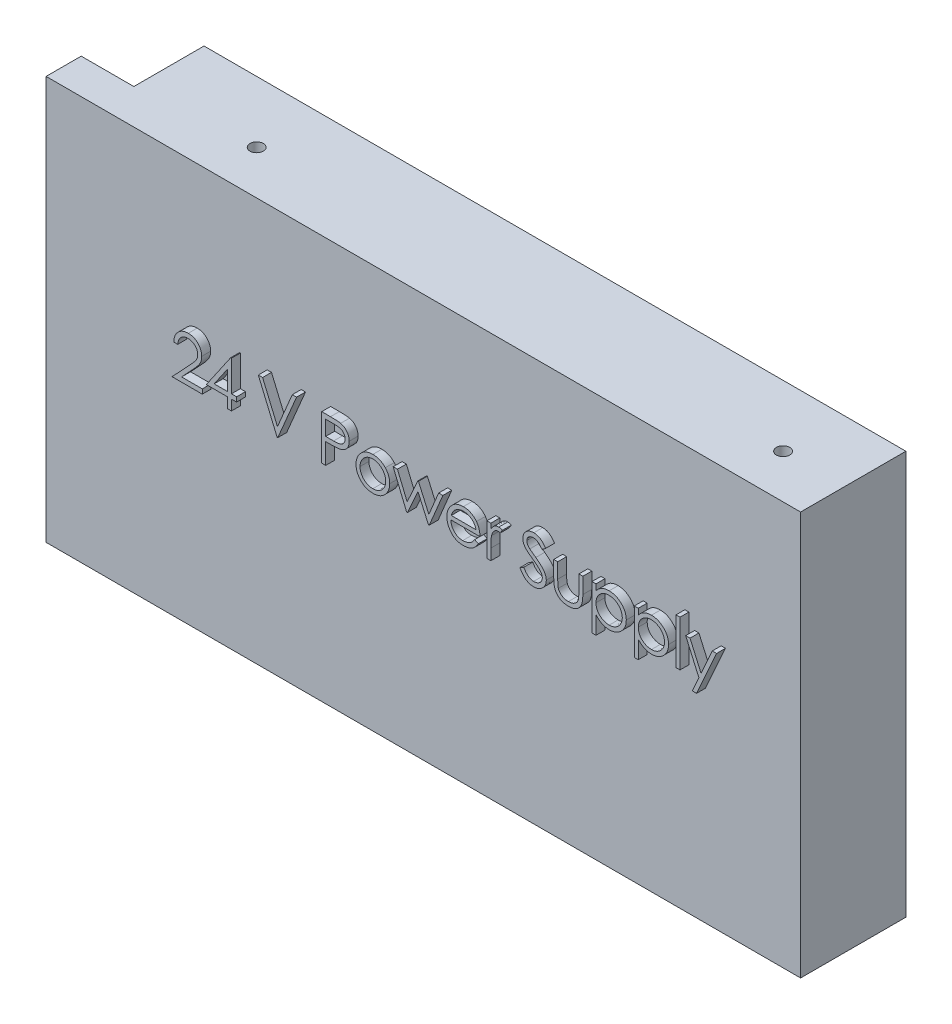
from build123d import *

# Parameters (mm, degrees)
SKETCH1_W           = 200
SKETCH1_H           = 115
BOSS_EXTRUDE1_DEPTH = 30
SKETCH2_W           = 1.13974359
SKETCH2_H           = 13.025641026
BOSS_EXTRUDE2_DEPTH = 2.54
SKETCH3_W           = 10
SKETCH3_H           = 115
BOSS_EXTRUDE3_DEPTH = 15
SKETCH4_R           = 1.905
CUT_EXTRUDE1_DEPTH  = 166.857926107


with BuildPart() as part:
    # Sketch1 → Boss-Extrude1 (new body)
    with BuildSketch(Plane.XY):
        Rectangle(SKETCH1_W, SKETCH1_H)
    extrude(amount=BOSS_EXTRUDE1_DEPTH)

    # Sketch2 → Boss-Extrude2 (add)
    # profile 1 of 14: a face of its own
    with BuildSketch(Plane.XY.offset(30)):
        with BuildLine():
            Line((-74.950266269, 12.669889224), (-76.090009858, 12.669889224))
            add(Edge.make_bspline(
                [(-76.090009858, 12.669889224), (-76.082581617, 12.821095016), (-76.06799275, 13.118059169), (-75.999672958, 13.551034487), (-75.90191606, 13.964890471), (-75.763698499, 14.356304159), (-75.592044291, 14.728736402), (-75.386195334, 15.080707887), (-75.142377648, 15.410875915), (-74.86585607, 15.716179718), (-74.565524151, 15.996260332), (-74.241471171, 16.238123642), (-73.900947786, 16.442476335), (-73.54498711, 16.613313984), (-73.169573065, 16.741547139), (-72.778112409, 16.836694231), (-72.368885257, 16.893939828), (-72.090065749, 16.900093108), (-71.948263064, 16.903222557)],
                knots=[0, 0, 0, 0, 1.10065271, 2.161652631, 3.183658789, 4.190468796, 5.17591951, 6.163126047, 7.15150782, 8.156236427, 9.156009102, 10.134482811, 11.092018607, 12.041330605, 13.001268258, 13.972401359, 14.968799086, 16, 16, 16, 16], degree=3))
            add(Edge.make_bspline(
                [(-71.948263064, 16.903222557), (-71.80900548, 16.899962444), (-71.535369304, 16.893556437), (-71.136001423, 16.83854356), (-70.755809526, 16.752380984), (-70.395536773, 16.631493616), (-70.058057625, 16.468990123), (-69.740836863, 16.273781911), (-69.440097921, 16.048012809), (-69.169381878, 15.782206114), (-68.920795419, 15.498443176), (-68.706338664, 15.195501355), (-68.522685185, 14.882612232), (-68.369604175, 14.557389901), (-68.256914757, 14.216772169), (-68.171359545, 13.865718033), (-68.123000073, 13.500593719), (-68.115578107, 13.253464217), (-68.11180473, 13.127821916)],
                knots=[0, 0, 0, 0, 1.111607364, 2.184268762, 3.212621178, 4.221274766, 5.211760367, 6.196651075, 7.1921475, 8.207485113, 9.220403448, 10.201281604, 11.166441695, 12.114753415, 13.065576456, 14.026450734, 14.996634279, 16, 16, 16, 16], degree=3))
            add(Edge.make_bspline(
                [(-68.11180473, 13.127821916), (-68.117948855, 12.950936916), (-68.130129285, 12.600270998), (-68.234321452, 12.084959925), (-68.39705022, 11.585692375), (-68.592983487, 11.183874165), (-68.790640641, 10.860084059), (-68.968758168, 10.593497615), (-69.17727334, 10.306457773), (-69.419221032, 9.99992572), (-69.689596311, 9.671500436), (-69.990848161, 9.321380321), (-70.325124796, 8.953182757), (-70.559742784, 8.701702432), (-70.681315948, 8.571391627)],
                knots=[0, 0, 0, 0, 1.184426356, 2.348067706, 3.509069118, 4.696110526, 5.333549288, 6.050745305, 6.844228056, 7.710549037, 8.667450064, 9.695053472, 10.805634456, 12, 12, 12, 12], degree=3))
            Line((-70.681315948, 8.571391627), (-73.858860019, 5.180145634))
            Line((-73.858860019, 5.180145634), (-67.948984217, 5.180145634))
            Line((-67.948984217, 5.180145634), (-67.948984217, 3.877581531))
            Line((-67.948984217, 3.877581531), (-76.578471397, 3.877581531))
            Line((-76.578471397, 3.877581531), (-71.653150884, 9.133631211))
            add(Edge.make_bspline(
                [(-71.653150884, 9.133631211), (-71.533234266, 9.25881078), (-71.302898985, 9.499255115), (-70.977116492, 9.850293856), (-70.684512163, 10.175956475), (-70.423191909, 10.475627665), (-70.198824618, 10.753690782), (-69.999716805, 11.001140135), (-69.840184518, 11.228849141), (-69.667045796, 11.492793654), (-69.499355064, 11.815055491), (-69.355255943, 12.208877735), (-69.267390636, 12.614288052), (-69.256850233, 12.888252586), (-69.25154832, 13.026059095)],
                knots=[0, 0, 0, 0, 1.329631726, 2.553950428, 3.673215718, 4.687767853, 5.603093632, 6.413772471, 7.123043292, 7.734684054, 8.834405432, 9.900288307, 10.943827018, 12, 12, 12, 12], degree=3))
            add(Edge.make_bspline(
                [(-69.25154832, 13.026059095), (-69.253855156, 13.112714455), (-69.258401488, 13.28349553), (-69.298525133, 13.533887855), (-69.359160398, 13.775423037), (-69.446047477, 14.008844026), (-69.560734791, 14.231803964), (-69.700338198, 14.444574249), (-69.861410714, 14.650274208), (-70.047742463, 14.843144747), (-70.252435692, 15.019787978), (-70.468677683, 15.176266803), (-70.69745949, 15.30703729), (-70.937816505, 15.41423798), (-71.189078637, 15.498331506), (-71.451731855, 15.556601209), (-71.725050428, 15.593186222), (-71.911680541, 15.598136217), (-72.006776685, 15.600658454)],
                knots=[0, 0, 0, 0, 0.991446411, 1.95395049, 2.89581595, 3.838931463, 4.798493298, 5.75982156, 6.748411868, 7.785213223, 8.824556874, 9.840280684, 10.836137867, 11.835679398, 12.848801643, 13.863922112, 14.911575587, 16, 16, 16, 16], degree=3))
            add(Edge.make_bspline(
                [(-72.006776685, 15.600658454), (-72.106093707, 15.598063909), (-72.301135939, 15.59296865), (-72.587499287, 15.557326412), (-72.860679108, 15.495837219), (-73.121362585, 15.411739001), (-73.369990796, 15.304846552), (-73.605354613, 15.171707936), (-73.826925668, 15.012836404), (-74.035120482, 14.832712099), (-74.226941206, 14.63216966), (-74.395477012, 14.408613509), (-74.542739007, 14.166125459), (-74.67122394, 13.905359804), (-74.775566015, 13.623950374), (-74.855297161, 13.32289613), (-74.918386576, 13.00350426), (-74.939463208, 12.782941238), (-74.950266269, 12.669889224)],
                knots=[0, 0, 0, 0, 1.031018746, 2.02475058, 2.990194455, 3.934040569, 4.864654155, 5.795059489, 6.735614925, 7.690564532, 8.649604399, 9.611025574, 10.590972636, 11.591080095, 12.624614302, 13.701020113, 14.821632451, 16, 16, 16, 16], degree=3))
        make_face()
    # profile 2 of 14: a face of its own
    with BuildSketch(Plane.XY.offset(30)):
        Polygon((-59.87664848, 16.903222557), (-59.645138064, 16.903222557), (-59.645138064, 8.110914865), (-58.179753448, 8.110914865), (-58.179753448, 6.808350762), (-59.645138064, 6.808350762), (-59.645138064, 3.877581531), (-60.784881653, 3.877581531), (-60.784881653, 6.808350762), (-66.809240628, 6.808350762), align=None)
        Polygon((-60.784881653, 8.110914865), (-60.784881653, 13.626459736), (-64.570458576, 8.110914865), align=None, mode=Mode.SUBTRACT)
    # profile 3 of 14: a face of its own
    with BuildSketch(Plane.XY.offset(30)):
        Polygon((-51.992573961, 16.577581531), (-50.771420115, 16.577581531), (-46.538086781, 6.569208134), (-42.304753448, 16.577581531), (-41.083599602, 16.577581531), (-46.456676525, 3.877581531), (-46.619497038, 3.877581531), align=None)
    # profile 4 of 14: a face of its own
    with BuildSketch(Plane.XY.offset(30)):
        with BuildLine():
            Line((-33.919497038, 16.577581531), (-31.428852006, 16.577581531))
            add(Edge.make_bspline(
                [(-31.428852006, 16.577581531), (-31.257543861, 16.577393222), (-30.929309847, 16.577032413), (-30.458629502, 16.566093193), (-30.031148476, 16.551482053), (-29.647788522, 16.531227755), (-29.307370109, 16.507291556), (-29.011433622, 16.47371987), (-28.757652946, 16.438666798), (-28.605592401, 16.403029123), (-28.536243833, 16.386776243)],
                knots=[0, 0, 0, 0, 1.415646017, 2.712440637, 3.8905458, 4.950247383, 5.884950622, 6.709939814, 7.411656543, 8, 8, 8, 8], degree=3))
            add(Edge.make_bspline(
                [(-28.536243833, 16.386776243), (-28.448455867, 16.362748025), (-28.27494855, 16.315257784), (-28.024936194, 16.220139416), (-27.787069383, 16.107355559), (-27.560532014, 15.978817263), (-27.348107884, 15.829009645), (-27.146627678, 15.664005375), (-26.957869464, 15.479994826), (-26.782894699, 15.279041855), (-26.622204148, 15.064519951), (-26.48384787, 14.833226717), (-26.367997646, 14.589055416), (-26.26863549, 14.332175886), (-26.197121955, 14.060430998), (-26.143248919, 13.775708928), (-26.109054613, 13.478040194), (-26.105779603, 13.274622961), (-26.104112422, 13.171071115)],
                knots=[0, 0, 0, 0, 0.999701418, 1.975846123, 2.934577507, 3.890451536, 4.834027766, 5.787354733, 6.749476667, 7.726910423, 8.712836071, 9.690891519, 10.682875813, 11.679750201, 12.712814741, 13.765529915, 14.8625177, 16, 16, 16, 16], degree=3))
            add(Edge.make_bspline(
                [(-26.104112422, 13.171071115), (-26.105641592, 13.066648896), (-26.108633516, 12.862339773), (-26.144542894, 12.563444227), (-26.192912447, 12.277808926), (-26.267287465, 12.006067205), (-26.364698908, 11.749832838), (-26.478970071, 11.505190082), (-26.616796024, 11.276300987), (-26.775164406, 11.062334589), (-26.951337334, 10.86309005), (-27.144569424, 10.680011224), (-27.354080571, 10.514169768), (-27.579204937, 10.365193892), (-27.822137246, 10.236538249), (-28.07919306, 10.1213046), (-28.352606702, 10.024526751), (-28.541809539, 9.973617671), (-28.638006653, 9.947733775)],
                knots=[0, 0, 0, 0, 1.121902311, 2.195077645, 3.232258892, 4.234102512, 5.217864754, 6.176164875, 7.132989551, 8.084763148, 9.034132444, 9.988522005, 10.94243251, 11.903244335, 12.886203696, 13.894208494, 14.929344452, 16, 16, 16, 16], degree=3))
            add(Edge.make_bspline(
                [(-28.638006653, 9.947733775), (-28.717571551, 9.930813815), (-28.89194265, 9.893732739), (-29.179117671, 9.852336339), (-29.513473785, 9.817002759), (-29.89455463, 9.79051006), (-30.322018142, 9.767830151), (-30.796095561, 9.749803068), (-31.317717498, 9.739897598), (-31.68155887, 9.739386721), (-31.871520275, 9.739119993)],
                knots=[0, 0, 0, 0, 0.601384939, 1.31797006, 2.144135048, 3.087295005, 4.142315834, 5.309527816, 6.595305764, 8, 8, 8, 8], degree=3))
            Line((-31.871520275, 9.739119993), (-32.779753448, 9.739119993))
            Line((-32.779753448, 9.739119993), (-32.779753448, 3.877581531))
            Line((-32.779753448, 3.877581531), (-33.919497038, 3.877581531))
            Line((-33.919497038, 3.877581531), (-33.919497038, 16.577581531))
        make_face()
        with BuildLine():
            Line((-32.779753448, 15.275017429), (-32.779753448, 11.041684095))
            Line((-32.779753448, 11.041684095), (-30.55623582, 11.01369932))
            add(Edge.make_bspline(
                [(-30.55623582, 11.01369932), (-30.447669232, 11.013643209), (-30.238083672, 11.013534888), (-29.935329376, 11.027995556), (-29.654444248, 11.044688918), (-29.396291075, 11.069130697), (-29.160753484, 11.10367926), (-28.947438736, 11.138556138), (-28.758000881, 11.189012739), (-28.536298063, 11.256950733), (-28.289252774, 11.37282051), (-28.020493384, 11.541004396), (-27.792725827, 11.755382966), (-27.595628008, 11.996421097), (-27.439215251, 12.264569367), (-27.324712079, 12.551476651), (-27.257434165, 12.854200562), (-27.248412833, 13.061348952), (-27.243856012, 13.165982974)],
                knots=[0, 0, 0, 0, 1.160613943, 2.240541288, 3.23993089, 4.169200891, 5.011653406, 5.7853311, 6.478053781, 7.106038997, 8.262395093, 9.384106736, 10.481365981, 11.59014053, 12.70357646, 13.786202915, 14.881775077, 16, 16, 16, 16], degree=3))
            add(Edge.make_bspline(
                [(-27.243856012, 13.165982974), (-27.248437615, 13.26808558), (-27.257545275, 13.471052923), (-27.325239407, 13.768518712), (-27.438992632, 14.052402554), (-27.596677989, 14.317190606), (-27.788052946, 14.557361409), (-28.010481991, 14.765993842), (-28.263441539, 14.933712591), (-28.498747978, 15.041964785), (-28.707757996, 15.108060213), (-28.889302536, 15.154305777), (-29.094282983, 15.191228691), (-29.322766069, 15.221126315), (-29.572980866, 15.246720303), (-29.847077037, 15.264086563), (-30.144016257, 15.274251848), (-30.350157471, 15.274756057), (-30.45701707, 15.275017429)],
                knots=[0, 0, 0, 0, 1.120700087, 2.227813068, 3.331159281, 4.466773991, 5.599788987, 6.693661531, 7.80175334, 8.91857717, 9.525282508, 10.207424825, 10.974604443, 11.810962634, 12.737642355, 13.736264703, 14.826523623, 16, 16, 16, 16], degree=3))
            Line((-30.45701707, 15.275017429), (-32.779753448, 15.275017429))
        make_face(mode=Mode.SUBTRACT)
    # profile 5 of 14: a face of its own
    with BuildSketch(Plane.XY.offset(30)):
        with BuildLine():
            add(Edge.make_bspline(
                [(-19.341972999, 13.321171275), (-19.167833238, 13.31746327), (-18.826387723, 13.310192778), (-18.326341966, 13.232487046), (-17.849021044, 13.113660895), (-17.392596861, 12.949389798), (-16.962914875, 12.729201006), (-16.553716361, 12.466458721), (-16.166123214, 12.155190453), (-15.933811079, 11.914405462), (-15.815891269, 11.792184897)],
                knots=[0, 0, 0, 0, 1.054011418, 2.066658804, 3.057071809, 4.030435133, 4.997543892, 5.974964718, 6.972108034, 8, 8, 8, 8], degree=3))
            add(Edge.make_bspline(
                [(-15.815891269, 11.792184897), (-15.71435675, 11.675294148), (-15.513252684, 11.443774809), (-15.255385647, 11.068378728), (-15.033238843, 10.67961322), (-14.855210385, 10.272315778), (-14.714839013, 9.850041971), (-14.615177773, 9.411340388), (-14.555898037, 8.957179871), (-14.547904414, 8.648737373), (-14.543856012, 8.492525442)],
                knots=[0, 0, 0, 0, 1.025258237, 2.030674902, 3.01204498, 3.988269485, 4.97094183, 5.956517959, 6.965070386, 8, 8, 8, 8], degree=3))
            add(Edge.make_bspline(
                [(-14.543856012, 8.492525442), (-14.547416865, 8.335408089), (-14.554453275, 8.024936874), (-14.621014398, 7.567666604), (-14.724541481, 7.124273962), (-14.872702722, 6.696615273), (-15.062687862, 6.283383299), (-15.294519785, 5.886382935), (-15.569825367, 5.504830908), (-15.881897013, 5.141967095), (-16.226799535, 4.807535402), (-16.600963844, 4.516058538), (-16.997037052, 4.266334721), (-17.420285791, 4.065179727), (-17.866844958, 3.906575957), (-18.337677748, 3.795178755), (-18.832052717, 3.727826359), (-19.169608635, 3.719177393), (-19.341972999, 3.714761019)],
                knots=[0, 0, 0, 0, 0.998656419, 1.973391657, 2.932242238, 3.890759089, 4.846373663, 5.82037756, 6.809684879, 7.83454468, 8.860553229, 9.859544525, 10.845671541, 11.83227036, 12.833544569, 13.85385346, 14.904124723, 16, 16, 16, 16], degree=3))
            add(Edge.make_bspline(
                [(-19.341972999, 3.714761019), (-19.515181839, 3.719192216), (-19.854420101, 3.727870941), (-20.350540093, 3.794917081), (-20.82221671, 3.906524618), (-21.269360482, 4.065700948), (-21.694428926, 4.26634115), (-22.092797073, 4.515303567), (-22.467265337, 4.807621844), (-22.812240824, 5.141943673), (-23.124292906, 5.504836943), (-23.399603536, 5.886381368), (-23.631434148, 6.283383707), (-23.821419631, 6.696615164), (-23.969580781, 7.124273991), (-24.073107888, 7.567666596), (-24.139669004, 8.024936876), (-24.146705416, 8.33540809), (-24.150266269, 8.492525442)],
                knots=[0, 0, 0, 0, 1.099876186, 2.154163076, 3.173186993, 4.173200201, 5.163417411, 6.152872554, 7.150605724, 8.17532212, 9.198891216, 10.186952605, 11.159729845, 12.11414092, 13.071450619, 14.029093627, 15.002601286, 16, 16, 16, 16], degree=3))
            add(Edge.make_bspline(
                [(-24.150266269, 8.492525442), (-24.146190257, 8.647888337), (-24.138120454, 8.955480168), (-24.078900321, 9.408786931), (-23.979627845, 9.846746029), (-23.839088206, 10.267389899), (-23.659418799, 10.672902481), (-23.440393554, 11.062628582), (-23.179896116, 11.436327172), (-22.979591892, 11.667547291), (-22.878231012, 11.784552685)],
                knots=[0, 0, 0, 0, 1.031353054, 2.041901799, 3.029428768, 4.008703097, 4.981709435, 5.96992636, 6.972712378, 8, 8, 8, 8], degree=3))
            add(Edge.make_bspline(
                [(-22.878231012, 11.784552685), (-22.760488982, 11.907833179), (-22.528928562, 12.150285962), (-22.139406035, 12.460646836), (-21.73121417, 12.728856589), (-21.296783724, 12.944670285), (-20.840734496, 13.114627193), (-20.360967531, 13.23279349), (-19.859224946, 13.309912807), (-19.516108607, 13.317381052), (-19.341972999, 13.321171275)],
                knots=[0, 0, 0, 0, 1.027980169, 2.021703884, 2.998553061, 3.971491411, 4.943284454, 5.930300938, 6.949603206, 8, 8, 8, 8], degree=3))
        make_face()
        with BuildLine():
            add(Edge.make_bspline(
                [(-19.34706114, 12.181427685), (-19.470206187, 12.177927595), (-19.713317311, 12.17101777), (-20.071165519, 12.118461887), (-20.415662649, 12.03519523), (-20.747462283, 11.916889083), (-21.065445509, 11.764130221), (-21.369916769, 11.576502742), (-21.661771622, 11.356491729), (-21.935300824, 11.104441463), (-22.186333785, 10.829109112), (-22.405782443, 10.535745067), (-22.592382114, 10.229107753), (-22.747830691, 9.908878301), (-22.863608202, 9.571811542), (-22.94769317, 9.22172468), (-23.000199471, 8.857904455), (-23.00704433, 8.610577331), (-23.010522679, 8.48489323)],
                knots=[0, 0, 0, 0, 1.021534396, 2.016698045, 2.994645724, 3.958388632, 4.93408049, 5.916473867, 6.921342795, 7.962252576, 8.998418191, 10.008913653, 10.997312074, 11.973003931, 12.956656626, 13.948281152, 14.957379055, 16, 16, 16, 16], degree=3))
            add(Edge.make_bspline(
                [(-23.010522679, 8.48489323), (-23.004692205, 8.322507303), (-22.993119803, 8.000201603), (-22.899011945, 7.525544101), (-22.74158173, 7.06986138), (-22.528993601, 6.635824779), (-22.262633893, 6.234242513), (-21.948809394, 5.876205984), (-21.590888195, 5.567103183), (-21.193136895, 5.310632686), (-20.763679798, 5.106853001), (-20.30917829, 4.962439575), (-19.8351392, 4.868562291), (-19.51117769, 4.859231513), (-19.34706114, 4.854504608)],
                knots=[0, 0, 0, 0, 1.016792936, 2.018143844, 3.017858371, 4.030088057, 5.03801393, 6.028138512, 7.003788237, 7.991172063, 8.984598303, 9.972568034, 10.972917682, 12, 12, 12, 12], degree=3))
            add(Edge.make_bspline(
                [(-19.34706114, 4.854504608), (-19.18295403, 4.859259054), (-18.859011153, 4.868644197), (-18.385630712, 4.961966772), (-17.932371442, 5.107485769), (-17.503360408, 5.310403502), (-17.105790161, 5.568077121), (-16.745294778, 5.874460547), (-16.434149818, 6.235190807), (-16.168053594, 6.636356698), (-15.951983985, 7.06918849), (-15.795290653, 7.525628203), (-15.700956555, 8.000180184), (-15.689414691, 8.322500127), (-15.683599602, 8.48489323)],
                knots=[0, 0, 0, 0, 1.02726834, 2.027799167, 3.010890988, 4.004497153, 4.992059811, 5.971914811, 6.958719428, 7.966827853, 8.981595046, 9.981490638, 10.983022906, 12, 12, 12, 12], degree=3))
            add(Edge.make_bspline(
                [(-15.683599602, 8.48489323), (-15.687076753, 8.610578082), (-15.693919256, 8.857906684), (-15.746442698, 9.221716158), (-15.830464228, 9.571842809), (-15.946475525, 9.908762935), (-16.101248661, 10.22993688), (-16.291446738, 10.534844746), (-16.509999316, 10.830125356), (-16.764061441, 11.103551424), (-17.037305126, 11.356589986), (-17.329278265, 11.576588056), (-17.633298044, 11.763305616), (-17.950357473, 11.918195689), (-18.282199647, 12.034118896), (-18.626214087, 12.118942673), (-18.982535483, 12.170795672), (-19.22477544, 12.177861014), (-19.34706114, 12.181427685)],
                knots=[0, 0, 0, 0, 1.042956736, 2.052379634, 3.044323526, 4.02829302, 5.004299113, 5.996692471, 7.007513377, 8.048758398, 9.090003419, 10.095195979, 11.07790575, 12.047570684, 13.018257071, 13.989683339, 14.985167495, 16, 16, 16, 16], degree=3))
        make_face(mode=Mode.SUBTRACT)
    # profile 6 of 14: a face of its own
    with BuildSketch(Plane.XY.offset(30)):
        Polygon((-13.566932935, 13.158350762), (-12.343235019, 13.158350762), (-9.577830371, 6.482709736), (-6.54784239, 13.158350762), (-6.354493031, 13.158350762), (-3.390650884, 6.482709736), (-0.599805531, 13.158350762), (0.59845168, 13.158350762), (-3.281255852, 3.877581531), (-3.51785441, 3.877581531), (-6.484240628, 10.553222557), (-9.511684538, 3.877581531), (-9.72284239, 3.877581531), align=None)
    # profile 7 of 14: a face of its own
    with BuildSketch(Plane.XY.offset(30)):
        with BuildLine():
            Line((9.680783411, 6.808350762), (10.693323475, 6.276640025))
            add(Edge.make_bspline(
                [(10.693323475, 6.276640025), (10.612636401, 6.13351708), (10.455651307, 5.855056507), (10.185682879, 5.47248947), (9.902683073, 5.128327759), (9.593877246, 4.83176587), (9.268504411, 4.57322513), (8.924760207, 4.347027881), (8.560855068, 4.154283535), (8.176771781, 3.991895791), (7.769284838, 3.867038484), (7.337406764, 3.778848883), (6.880310195, 3.724335879), (6.566996914, 3.718003511), (6.406564661, 3.714761019)],
                knots=[0, 0, 0, 0, 1.120438281, 2.179929193, 3.190490725, 4.156257408, 5.095198341, 6.022838206, 6.959905092, 7.901321166, 8.864066838, 9.862729781, 10.905609505, 12, 12, 12, 12], degree=3))
            add(Edge.make_bspline(
                [(6.406564661, 3.714761019), (6.228249485, 3.718923626), (5.880408236, 3.727043668), (5.374078296, 3.797047753), (4.897358692, 3.911247454), (4.450276226, 4.070779562), (4.033925767, 4.27915871), (3.647479808, 4.533011686), (3.288906099, 4.831034439), (2.969503969, 5.175808391), (2.68196188, 5.544768636), (2.428231048, 5.929237131), (2.216114084, 6.328246546), (2.043566041, 6.739256733), (1.904211245, 7.159677147), (1.807086349, 7.593333043), (1.751098406, 8.039050735), (1.742518847, 8.340575353), (1.73819527, 8.492525442)],
                knots=[0, 0, 0, 0, 1.145258523, 2.234067595, 3.276747158, 4.290159414, 5.277019952, 6.260822364, 7.254936242, 8.264827045, 9.274100331, 10.257902744, 11.220704747, 12.172965371, 13.118907548, 14.062713208, 15.023725156, 16, 16, 16, 16], degree=3))
            add(Edge.make_bspline(
                [(1.73819527, 8.492525442), (1.74203844, 8.635109541), (1.749655095, 8.917692395), (1.797663952, 9.335941657), (1.882747759, 9.742444899), (1.999501848, 10.137539896), (2.150273513, 10.520565125), (2.334721851, 10.891753699), (2.553134194, 11.250710635), (2.72176361, 11.477144863), (2.806704885, 11.591203326)],
                knots=[0, 0, 0, 0, 1.024358464, 2.0301432, 3.019427413, 4.004406732, 4.986367066, 5.972626655, 6.978780325, 8, 8, 8, 8], degree=3))
            add(Edge.make_bspline(
                [(2.806704885, 11.591203326), (2.921758477, 11.728613226), (3.148221055, 11.999080229), (3.53123983, 12.35445644), (3.945986257, 12.652158138), (4.387262728, 12.89892689), (4.860197934, 13.086428409), (5.358434505, 13.226155921), (5.887645632, 13.304453276), (6.249433147, 13.315512558), (6.434549436, 13.321171275)],
                knots=[0, 0, 0, 0, 1.030682036, 2.02871468, 2.997146059, 3.962720338, 4.930598197, 5.918074684, 6.934738563, 8, 8, 8, 8], degree=3))
            add(Edge.make_bspline(
                [(6.434549436, 13.321171275), (6.624859319, 13.316258012), (6.998203925, 13.30661931), (7.542606193, 13.2172609), (8.057720793, 13.075555916), (8.543341594, 12.875426448), (8.999517832, 12.617218931), (9.423284355, 12.297389964), (9.821888415, 11.925758618), (10.053785258, 11.639960687), (10.17178902, 11.494528647)],
                knots=[0, 0, 0, 0, 1.056321875, 2.072262726, 3.055038591, 4.01806755, 4.982017516, 5.957941055, 6.960871419, 8, 8, 8, 8], degree=3))
            add(Edge.make_bspline(
                [(10.17178902, 11.494528647), (10.252078196, 11.384932794), (10.412122119, 11.166470592), (10.612590168, 10.810249536), (10.786607001, 10.437556808), (10.925700889, 10.042368016), (11.038329936, 9.629365539), (11.119816107, 9.195596877), (11.167603008, 8.741191199), (11.176996282, 8.431577697), (11.181785013, 8.273735377)],
                knots=[0, 0, 0, 0, 0.94817472, 1.890038105, 2.849395472, 3.817997239, 4.812318967, 5.836947057, 6.897266129, 8, 8, 8, 8], degree=3))
            Line((11.181785013, 8.273735377), (2.87793886, 8.273735377))
            add(Edge.make_bspline(
                [(2.87793886, 8.273735377), (2.883525431, 8.151450836), (2.8945112, 7.910983216), (2.945729005, 7.559117804), (3.02646027, 7.223934533), (3.139922297, 6.907947495), (3.27732485, 6.607029604), (3.445638737, 6.32341307), (3.646442261, 6.058389724), (3.87041837, 5.809588967), (4.119726973, 5.588025634), (4.382010084, 5.38971776), (4.661023877, 5.223508881), (4.954568352, 5.088598995), (5.262168829, 4.982984648), (5.583922223, 4.910892842), (5.919195388, 4.862607054), (6.147743623, 4.857237983), (6.264096712, 4.854504608)],
                knots=[0, 0, 0, 0, 1.094153842, 2.151609401, 3.174256925, 4.172055639, 5.149267565, 6.128595816, 7.11444997, 8.118368179, 9.117203808, 10.09244225, 11.054858984, 12.015122123, 12.976791628, 13.957293641, 14.960065497, 16, 16, 16, 16], degree=3))
            add(Edge.make_bspline(
                [(6.264096712, 4.854504608), (6.377856591, 4.856710985), (6.603578012, 4.861088861), (6.93973198, 4.903658937), (7.270438265, 4.972493937), (7.594328119, 5.066437616), (7.904828045, 5.181016479), (8.192376184, 5.31927542), (8.456827252, 5.472218786), (8.703994531, 5.647151036), (8.94373785, 5.861266457), (9.181563443, 6.128458931), (9.4365673, 6.444462246), (9.596186679, 6.682299377), (9.680783411, 6.808350762)],
                knots=[0, 0, 0, 0, 0.99110716, 1.966546729, 2.947904876, 3.932708344, 4.903319531, 5.828989031, 6.710028674, 7.56322171, 8.463672341, 9.504779593, 10.677557249, 12, 12, 12, 12], degree=3))
        make_face()
        with BuildLine():
            add(Edge.make_bspline(
                [(10.042041424, 9.413478967), (10.0003251, 9.56465568), (9.920034606, 9.855622189), (9.752262655, 10.258541992), (9.563317351, 10.61663809), (9.339718497, 10.927169901), (9.086376264, 11.202954077), (8.793749458, 11.443958657), (8.465596359, 11.659559123), (8.103613191, 11.841541049), (7.720284428, 11.996444251), (7.31894196, 12.100312528), (6.909429416, 12.171467153), (6.632445005, 12.178093318), (6.493063058, 12.181427685)],
                knots=[0, 0, 0, 0, 1.154881502, 2.222775134, 3.210006277, 4.132804581, 5.035138423, 5.962687519, 6.919655026, 7.923214229, 8.944639381, 9.960483929, 10.97369054, 12, 12, 12, 12], degree=3))
            add(Edge.make_bspline(
                [(6.493063058, 12.181427685), (6.379309381, 12.179208191), (6.154442278, 12.174820718), (5.82314983, 12.133200535), (5.50499778, 12.064403384), (5.197638593, 11.970187684), (4.905100014, 11.844607898), (4.621364712, 11.697348761), (4.353647274, 11.517583586), (4.186220288, 11.380572884), (4.101636776, 11.31135557)],
                knots=[0, 0, 0, 0, 1.04873581, 2.073130211, 3.073294108, 4.04793562, 5.032784715, 6.005352987, 6.992311501, 8, 8, 8, 8], degree=3))
            add(Edge.make_bspline(
                [(4.101636776, 11.31135557), (4.04106401, 11.256584767), (3.918479495, 11.145742012), (3.754683888, 10.954773177), (3.597855316, 10.74884608), (3.455130347, 10.520082342), (3.324220248, 10.271086944), (3.201719759, 10.003960096), (3.091460492, 9.716674738), (3.029426036, 9.516477601), (2.997510174, 9.413478967)],
                knots=[0, 0, 0, 0, 0.879870761, 1.780643979, 2.707998968, 3.669668524, 4.684282772, 5.740141944, 6.837334558, 8, 8, 8, 8], degree=3))
            Line((2.997510174, 9.413478967), (10.042041424, 9.413478967))
        make_face(mode=Mode.SUBTRACT)
    # profile 8 of 14: a face of its own
    with BuildSketch(Plane.XY.offset(30)):
        with BuildLine():
            Line((13.135631167, 13.158350762), (14.275374757, 13.158350762))
            Line((14.275374757, 13.158350762), (14.275374757, 11.792184897))
            add(Edge.make_bspline(
                [(14.275374757, 11.792184897), (14.359516824, 11.919387474), (14.520437875, 12.162661414), (14.787910504, 12.484404306), (15.061879735, 12.750796047), (15.343657129, 12.963080243), (15.635314805, 13.122059275), (15.930451745, 13.238511145), (16.233711307, 13.307371688), (16.43749886, 13.316565251), (16.539597513, 13.321171275)],
                knots=[0, 0, 0, 0, 1.2804753, 2.448899062, 3.506932113, 4.484331642, 5.4025378, 6.288909075, 7.142734305, 8, 8, 8, 8], degree=3))
            add(Edge.make_bspline(
                [(16.539597513, 13.321171275), (16.618795898, 13.316851364), (16.781751722, 13.307962867), (17.028431405, 13.24551216), (17.282589073, 13.145806193), (17.44639145, 13.052043099), (17.531785013, 13.003162461)],
                knots=[0, 0, 0, 0, 0.901110191, 1.854092781, 2.881294221, 4, 4, 4, 4], degree=3))
            Line((17.531785013, 13.003162461), (16.905943667, 12.016063102))
            add(Edge.make_bspline(
                [(16.905943667, 12.016063102), (16.851119505, 12.040520639), (16.747052749, 12.086945726), (16.594817609, 12.141889592), (16.454459616, 12.174241629), (16.365038704, 12.179142804), (16.32335152, 12.181427685)],
                knots=[0, 0, 0, 0, 1.180555205, 2.24091978, 3.179933427, 4, 4, 4, 4], degree=3))
            add(Edge.make_bspline(
                [(16.32335152, 12.181427685), (16.231890715, 12.17533155), (16.045337186, 12.1628972), (15.771436288, 12.065147812), (15.505653571, 11.907213369), (15.294573539, 11.732058192), (15.131134507, 11.563156184), (15.014511403, 11.415660552), (14.90753115, 11.250275232), (14.805313493, 11.069827522), (14.712181511, 10.871236366), (14.625260283, 10.656485849), (14.546669552, 10.425327239), (14.501855809, 10.264282094), (14.478900398, 10.181788262)],
                knots=[0, 0, 0, 0, 1.125678352, 2.296057538, 3.5422874, 4.923748041, 5.663163013, 6.437101912, 7.23742474, 8.08941207, 8.991984279, 9.93940061, 10.944477711, 12, 12, 12, 12], degree=3))
            add(Edge.make_bspline(
                [(14.478900398, 10.181788262), (14.461728571, 10.108211089), (14.423694278, 9.945243243), (14.386713555, 9.671835739), (14.35017559, 9.348807034), (14.324425003, 8.975257969), (14.300556107, 8.552121386), (14.287093809, 8.078752669), (14.275833842, 7.554665938), (14.275532428, 7.188273285), (14.275374757, 6.99661198)],
                knots=[0, 0, 0, 0, 0.566838948, 1.255505196, 2.06880316, 3.007127437, 4.065329342, 5.249902469, 6.561414163, 8, 8, 8, 8], degree=3))
            Line((14.275374757, 6.99661198), (14.275374757, 3.877581531))
            Line((14.275374757, 3.877581531), (13.135631167, 3.877581531))
            Line((13.135631167, 3.877581531), (13.135631167, 13.158350762))
        make_face()
    # profile 9 of 14: a face of its own
    with BuildSketch(Plane.XY.offset(30)):
        with BuildLine():
            Line((22.579220911, 6.327521435), (23.652818667, 6.971171275))
            add(Edge.make_bspline(
                [(23.652818667, 6.971171275), (23.752670557, 6.804023364), (23.943982924, 6.483774417), (24.263120712, 6.051038098), (24.59380299, 5.683238272), (24.938478572, 5.382514582), (25.295043584, 5.145754336), (25.665825721, 4.978106238), (26.049575492, 4.873545413), (26.310737644, 4.860845099), (26.441119949, 4.854504608)],
                knots=[0, 0, 0, 0, 1.272034388, 2.437168799, 3.508375237, 4.49857839, 5.41946034, 6.295179144, 7.148887113, 8, 8, 8, 8], degree=3))
            add(Edge.make_bspline(
                [(26.441119949, 4.854504608), (26.552469415, 4.857605849), (26.773219991, 4.863754065), (27.098202987, 4.922830118), (27.413822669, 5.013588414), (27.713574012, 5.143567223), (27.993320956, 5.300824014), (28.238636679, 5.490765858), (28.450712576, 5.703422661), (28.624191363, 5.940668294), (28.757287491, 6.19581909), (28.859584425, 6.457714685), (28.916353692, 6.730469204), (28.92490534, 6.914112884), (28.929220911, 7.006788262)],
                knots=[0, 0, 0, 0, 1.095163259, 2.171163733, 3.241058638, 4.321873601, 5.38011039, 6.391990106, 7.366004449, 8.327778327, 9.272591725, 10.192022065, 11.087607919, 12, 12, 12, 12], degree=3))
            add(Edge.make_bspline(
                [(28.929220911, 7.006788262), (28.923871269, 7.112527917), (28.912996229, 7.327481183), (28.821079145, 7.644617067), (28.676483306, 7.958461535), (28.543087427, 8.152594699), (28.473832289, 8.253382813)],
                knots=[0, 0, 0, 0, 0.938893495, 1.908633276, 2.914225137, 4, 4, 4, 4], degree=3))
            add(Edge.make_bspline(
                [(28.473832289, 8.253382813), (28.416970346, 8.326124145), (28.29759581, 8.478835471), (28.092372835, 8.706148183), (27.851558649, 8.940620731), (27.583394321, 9.191206452), (27.278111399, 9.446250743), (26.945271561, 9.717915637), (26.576376987, 9.995869931), (26.317661671, 10.182278955), (26.184168828, 10.278462942)],
                knots=[0, 0, 0, 0, 0.722233717, 1.516239348, 2.393582979, 3.351407094, 4.387010283, 5.505090956, 6.712668013, 8, 8, 8, 8], degree=3))
            add(Edge.make_bspline(
                [(26.184168828, 10.278462942), (26.050550327, 10.373635245), (25.795081929, 10.555597443), (25.43781793, 10.825651273), (25.118342307, 11.072553314), (24.838075019, 11.298627872), (24.597139339, 11.503905609), (24.393636676, 11.686415274), (24.232751055, 11.851092767), (24.143286519, 11.957922778), (24.103119148, 12.00588682)],
                knots=[0, 0, 0, 0, 1.452282411, 2.77665338, 3.964542531, 5.026858415, 5.96415736, 6.766646006, 7.446254459, 8, 8, 8, 8], degree=3))
            add(Edge.make_bspline(
                [(24.103119148, 12.00588682), (24.046975912, 12.080639154), (23.936562705, 12.22764965), (23.790817485, 12.45742842), (23.666941094, 12.692644268), (23.569832061, 12.933929263), (23.488057781, 13.177896005), (23.433056147, 13.427727668), (23.398615935, 13.682303226), (23.395089012, 13.853620785), (23.393323475, 13.93938041)],
                knots=[0, 0, 0, 0, 1.068054152, 2.10047183, 3.106115577, 4.101338837, 5.06977816, 6.043150881, 7.020423561, 8, 8, 8, 8], degree=3))
            add(Edge.make_bspline(
                [(23.393323475, 13.93938041), (23.398059519, 14.073745592), (23.407430378, 14.339603994), (23.486680254, 14.727973008), (23.611767611, 15.098763721), (23.787009062, 15.448305218), (24.012914314, 15.767496063), (24.274338278, 16.060007859), (24.585711385, 16.305911), (24.927350904, 16.520766183), (25.301298311, 16.688935683), (25.693151018, 16.815794097), (26.103531822, 16.887673403), (26.381491767, 16.897988579), (26.522530206, 16.903222557)],
                knots=[0, 0, 0, 0, 1.005424448, 1.989358655, 2.955360095, 3.929531133, 4.905563448, 5.876582895, 6.856512386, 7.866279853, 8.892233794, 9.918561126, 10.94386622, 12, 12, 12, 12], degree=3))
            add(Edge.make_bspline(
                [(26.522530206, 16.903222557), (26.67218737, 16.898060727), (26.969807703, 16.887795494), (27.407592, 16.798541595), (27.829089456, 16.6508563), (28.168155017, 16.483257456), (28.433522466, 16.315866319), (28.63589781, 16.163394385), (28.840975417, 15.987861848), (29.050409502, 15.788801155), (29.260651323, 15.564385801), (29.474822136, 15.31615273), (29.693422768, 15.045618941), (29.834051175, 14.852490039), (29.906143988, 14.753482974)],
                knots=[0, 0, 0, 0, 1.286793592, 2.559021753, 3.825965368, 5.121522368, 5.803751409, 6.523245864, 7.299691795, 8.125521123, 9.008227632, 9.944561021, 10.946284179, 12, 12, 12, 12], degree=3))
            Line((29.906143988, 14.753482974), (28.87579543, 13.972453326))
            add(Edge.make_bspline(
                [(28.87579543, 13.972453326), (28.813580189, 14.052603717), (28.693768182, 14.20695463), (28.511869759, 14.423113404), (28.340424665, 14.620567487), (28.171513214, 14.79207238), (28.014056323, 14.947020121), (27.861231627, 15.07967981), (27.715238409, 15.191351256), (27.531208476, 15.31052646), (27.300004184, 15.428660058), (27.009774581, 15.528623856), (26.706475812, 15.588695081), (26.499902577, 15.596637615), (26.39532668, 15.600658454)],
                knots=[0, 0, 0, 0, 1.181633172, 2.275549214, 3.290209073, 4.226197932, 5.078386478, 5.862611352, 6.581680152, 7.217281963, 8.414376989, 9.595101626, 10.782541182, 12, 12, 12, 12], degree=3))
            add(Edge.make_bspline(
                [(26.39532668, 15.600658454), (26.264130156, 15.596261715), (26.011130018, 15.587783016), (25.651936876, 15.495181927), (25.328653205, 15.349379176), (25.050876754, 15.145036256), (24.819602581, 14.902934368), (24.65230563, 14.624336808), (24.551612176, 14.316697804), (24.539324818, 14.10209808), (24.533067065, 13.99280589)],
                knots=[0, 0, 0, 0, 1.14458467, 2.207223713, 3.21896685, 4.227309161, 5.202851033, 6.127160689, 7.046193047, 8, 8, 8, 8], degree=3))
            add(Edge.make_bspline(
                [(24.533067065, 13.99280589), (24.534493553, 13.924764811), (24.537348862, 13.788571392), (24.577171699, 13.587361947), (24.628332121, 13.386660801), (24.709403956, 13.187370286), (24.821328344, 12.98600504), (24.968304268, 12.779097592), (25.153409714, 12.56482425), (25.295203445, 12.42546035), (25.370066263, 12.35188041)],
                knots=[0, 0, 0, 0, 0.858281714, 1.717966888, 2.583508476, 3.4729293, 4.427298488, 5.488583878, 6.674047936, 8, 8, 8, 8], degree=3))
            add(Edge.make_bspline(
                [(25.370066263, 12.35188041), (25.3978661, 12.327071773), (25.46391215, 12.268132131), (25.584656223, 12.171640142), (25.744105805, 12.052612939), (25.938097221, 11.905338962), (26.170207362, 11.734500514), (26.440461752, 11.542281979), (26.745847885, 11.322443313), (26.962553123, 11.168745951), (27.077137578, 11.087477365)],
                knots=[0, 0, 0, 0, 0.420754252, 0.999615792, 1.744751191, 2.668019286, 3.750313428, 4.999500688, 6.413464383, 8, 8, 8, 8], degree=3))
            add(Edge.make_bspline(
                [(27.077137578, 11.087477365), (27.214972177, 10.987178717), (27.481869776, 10.792964287), (27.86162728, 10.501170248), (28.205956241, 10.215791202), (28.51606558, 9.9386496), (28.795018933, 9.671847662), (29.03972152, 9.412175551), (29.252666703, 9.161493615), (29.48191701, 8.840101698), (29.716169669, 8.445381764), (29.917343139, 7.961772155), (30.044192, 7.476282649), (30.06078007, 7.1499767), (30.068964501, 6.988979769)],
                knots=[0, 0, 0, 0, 1.163667725, 2.253281268, 3.268753668, 4.215851969, 5.092017293, 5.902905408, 6.650798638, 7.335211899, 8.59617414, 9.77448103, 10.901945474, 12, 12, 12, 12], degree=3))
            add(Edge.make_bspline(
                [(30.068964501, 6.988979769), (30.066580028, 6.875121129), (30.061857388, 6.649614909), (30.007570643, 6.318489344), (29.928033573, 5.996885903), (29.808155609, 5.688779866), (29.661840149, 5.388534585), (29.476179764, 5.104025918), (29.260977594, 4.828956986), (29.014112218, 4.570662603), (28.743979944, 4.333549263), (28.458470538, 4.122623811), (28.15711669, 3.946753038), (27.841553198, 3.803239982), (27.511707577, 3.690995504), (27.167690761, 3.609668808), (26.808935678, 3.559755228), (26.56509393, 3.554574494), (26.441119949, 3.551940506)],
                knots=[0, 0, 0, 0, 0.983748083, 1.948392443, 2.894712957, 3.844097841, 4.80183111, 5.778335162, 6.776009319, 7.81870978, 8.863265674, 9.881300176, 10.883814829, 11.87499822, 12.874611388, 13.892143829, 14.928324115, 16, 16, 16, 16], degree=3))
            add(Edge.make_bspline(
                [(26.441119949, 3.551940506), (26.345197419, 3.553795365), (26.154560404, 3.557481722), (25.872585998, 3.59007094), (25.59630806, 3.636179573), (25.32919338, 3.709382627), (25.067800486, 3.798199087), (24.813266235, 3.907558179), (24.565467268, 4.038612024), (24.323014896, 4.188453971), (24.086525748, 4.36283493), (23.858217965, 4.56593876), (23.630600635, 4.792163878), (23.410392082, 5.047653636), (23.193138101, 5.328280394), (22.983122158, 5.636669717), (22.775997068, 5.971141829), (22.646038085, 6.206509426), (22.579220911, 6.327521435)],
                knots=[0, 0, 0, 0, 0.915332311, 1.819136955, 2.706846663, 3.586547465, 4.459518054, 5.340707479, 6.227863349, 7.133153174, 8.059268498, 9.028702269, 10.047606654, 11.120612155, 12.245963614, 13.433783089, 14.680604001, 16, 16, 16, 16], degree=3))
        make_face()
    # profile 10 of 14: a face of its own
    with BuildSketch(Plane.XY.offset(30)):
        with BuildLine():
            Line((32.185631167, 13.158350762), (33.325374757, 13.158350762))
            Line((33.325374757, 13.158350762), (33.325374757, 8.853783454))
            add(Edge.make_bspline(
                [(33.325374757, 8.853783454), (33.325889669, 8.727426622), (33.326874672, 8.485711919), (33.333554657, 8.137894527), (33.349266711, 7.820696742), (33.36891116, 7.533935325), (33.394173769, 7.27765879), (33.424230534, 7.052762266), (33.457825378, 6.85669537), (33.490710083, 6.738609479), (33.506003763, 6.683691307)],
                knots=[0, 0, 0, 0, 1.388932606, 2.656963016, 3.823490214, 4.879454478, 5.816252168, 6.653371382, 7.373723809, 8, 8, 8, 8], degree=3))
            add(Edge.make_bspline(
                [(33.506003763, 6.683691307), (33.530538186, 6.614665461), (33.579096966, 6.478048799), (33.667175036, 6.280694409), (33.776135, 6.097904098), (33.895369232, 5.92262932), (34.03288994, 5.760062111), (34.186957164, 5.610476998), (34.352413624, 5.468222153), (34.598267566, 5.299911622), (34.934488331, 5.119515995), (35.375914043, 4.963865454), (35.854537949, 4.87084405), (36.185335644, 4.860051753), (36.355362738, 4.854504608)],
                knots=[0, 0, 0, 0, 0.725840625, 1.436591201, 2.137033971, 2.831655856, 3.53531722, 4.242432219, 4.957935707, 5.694543706, 7.190802206, 8.724350549, 10.316345118, 12, 12, 12, 12], degree=3))
            add(Edge.make_bspline(
                [(36.355362738, 4.854504608), (36.525374037, 4.86016971), (36.854314445, 4.871130635), (37.327679619, 4.961059475), (37.760391894, 5.111302975), (38.148108204, 5.321061298), (38.489069966, 5.577753926), (38.773203143, 5.878957317), (39.007635181, 6.215142235), (39.109995079, 6.465964619), (39.161472513, 6.592104769)],
                knots=[0, 0, 0, 0, 1.157059328, 2.238695713, 3.266970494, 4.264342957, 5.228770407, 6.160125903, 7.074715775, 8, 8, 8, 8], degree=3))
            add(Edge.make_bspline(
                [(39.161472513, 6.592104769), (39.176691577, 6.642782481), (39.210337209, 6.754818526), (39.246486313, 6.944882184), (39.279050788, 7.171539464), (39.30685717, 7.436273535), (39.326687903, 7.738392574), (39.337377771, 8.077802165), (39.349454655, 8.453436814), (39.349637957, 8.716391255), (39.349733731, 8.853783454)],
                knots=[0, 0, 0, 0, 0.557542046, 1.232589297, 2.036731608, 2.971723315, 4.038036528, 5.22795436, 6.551621927, 8, 8, 8, 8], degree=3))
            Line((39.349733731, 8.853783454), (39.349733731, 13.158350762))
            Line((39.349733731, 13.158350762), (40.489477321, 13.158350762))
            Line((40.489477321, 13.158350762), (40.489477321, 8.640081531))
            add(Edge.make_bspline(
                [(40.489477321, 8.640081531), (40.4878746, 8.486566938), (40.484765102, 8.188727627), (40.464781312, 7.755896708), (40.430492718, 7.352536562), (40.378449261, 6.978433679), (40.317250956, 6.633873674), (40.238306765, 6.318414941), (40.144042874, 6.033029417), (40.03770572, 5.772709255), (39.912077801, 5.536681953), (39.778448326, 5.312669133), (39.624144154, 5.106229054), (39.461692161, 4.907085299), (39.280983295, 4.725143185), (39.085403807, 4.55622783), (38.877706484, 4.397757114), (38.653282251, 4.255911615), (38.415407394, 4.128125502), (38.163788256, 4.014855733), (37.89534292, 3.925220667), (37.613534865, 3.847893394), (37.316983409, 3.787243749), (37.00597444, 3.74447535), (36.680612718, 3.718257721), (36.458872679, 3.715946158), (36.345186456, 3.714761019)],
                knots=[0, 0, 0, 0, 1.493040784, 2.896703357, 4.213163133, 5.428574705, 6.569057535, 7.615249723, 8.588095153, 9.490268104, 10.346124644, 11.18633936, 12.024365274, 12.850166724, 13.684164916, 14.514361689, 15.362232829, 16.222528818, 17.093394965, 17.986930858, 18.902426812, 19.842810585, 20.827885679, 21.843828298, 22.894529745, 24, 24, 24, 24], degree=3))
            add(Edge.make_bspline(
                [(36.345186456, 3.714761019), (36.232350533, 3.71599367), (36.010617441, 3.718415945), (35.685238926, 3.744330505), (35.373368269, 3.787177295), (35.076114251, 3.848337656), (34.793178581, 3.924679424), (34.523415197, 4.015406538), (34.269982839, 4.128184286), (34.029836711, 4.255102852), (33.804856616, 4.39866828), (33.59400549, 4.556032309), (33.397566054, 4.726960024), (33.215494978, 4.910737577), (33.050347892, 5.109644746), (32.900066826, 5.322081493), (32.76233821, 5.545942901), (32.637686657, 5.785657804), (32.530601144, 6.048990525), (32.436057823, 6.340354278), (32.35873065, 6.66294341), (32.295802264, 7.016482122), (32.245178466, 7.399278416), (32.210031607, 7.813546666), (32.190379878, 8.258277777), (32.187248198, 8.56543595), (32.185631167, 8.724035858)],
                knots=[0, 0, 0, 0, 1.083640291, 2.129454052, 3.13281866, 4.105697902, 5.042300162, 5.946461698, 6.836384745, 7.703652036, 8.553297018, 9.397182691, 10.228592656, 11.052265423, 11.879314572, 12.708807002, 13.549817954, 14.402308542, 15.300838682, 16.27712199, 17.341985831, 18.484375296, 19.725102775, 21.0496083, 22.476576903, 24, 24, 24, 24], degree=3))
            Line((32.185631167, 8.724035858), (32.185631167, 13.158350762))
        make_face()
    # profile 11 of 14: a face of its own
    with BuildSketch(Plane.XY.offset(30)):
        with BuildLine():
            Line((43.094605526, 13.158350762), (44.234349116, 13.158350762))
            Line((44.234349116, 13.158350762), (44.234349116, 11.441103166))
            add(Edge.make_bspline(
                [(44.234349116, 11.441103166), (44.35538913, 11.5969058), (44.590606173, 11.89967704), (44.996007971, 12.291526935), (45.42391382, 12.62200018), (45.885335346, 12.8810168), (46.373101307, 13.07630946), (46.885210001, 13.220652035), (47.426007805, 13.3057111), (47.795746362, 13.315949699), (47.984309052, 13.321171275)],
                knots=[0, 0, 0, 0, 1.0828784, 2.104357462, 3.088488658, 4.04616522, 5.001424249, 5.969181776, 6.964304535, 8, 8, 8, 8], degree=3))
            add(Edge.make_bspline(
                [(47.984309052, 13.321171275), (48.149015726, 13.316406312), (48.474567121, 13.306988111), (48.95376798, 13.243223027), (49.415232943, 13.133938829), (49.856351311, 12.976455508), (50.281848719, 12.781762802), (50.685426052, 12.536046702), (51.073369526, 12.251544238), (51.435922555, 11.924130434), (51.770917231, 11.569879296), (52.060644803, 11.188798363), (52.310551427, 10.793419836), (52.512555074, 10.377614244), (52.670791077, 9.944655896), (52.783330051, 9.492795553), (52.850304928, 9.023708569), (52.85929091, 8.704747269), (52.863836295, 8.543406852)],
                knots=[0, 0, 0, 0, 1.041296284, 2.058176809, 3.050446431, 4.034000596, 5.01514041, 6.003636468, 7.015969324, 8.052561599, 9.08815499, 10.094063707, 11.074456064, 12.040834395, 13.011057502, 13.983766392, 14.980127149, 16, 16, 16, 16], degree=3))
            add(Edge.make_bspline(
                [(52.863836295, 8.543406852), (52.859389534, 8.378661332), (52.850619877, 8.053759393), (52.782602284, 7.576649069), (52.673901627, 7.117680598), (52.517661934, 6.677617385), (52.315762819, 6.256762421), (52.070091986, 5.855419213), (51.780218234, 5.473716347), (51.44892557, 5.116835824), (51.089504916, 4.788089746), (50.705320883, 4.50056875), (50.302335639, 4.259118617), (49.882610918, 4.057431878), (49.442553601, 3.905423096), (48.984216851, 3.795775648), (48.507850205, 3.728159049), (48.183814596, 3.719261275), (48.019926039, 3.714761019)],
                knots=[0, 0, 0, 0, 1.038740735, 2.04854663, 3.033179607, 4.009277356, 4.987731542, 5.972001279, 6.972200261, 8.005528982, 9.039189865, 10.040446548, 11.026516639, 11.997840187, 12.972163198, 13.956796175, 14.96660207, 16, 16, 16, 16], degree=3))
            add(Edge.make_bspline(
                [(48.019926039, 3.714761019), (47.835494564, 3.719459321), (47.471188329, 3.728739845), (46.938522496, 3.822790276), (46.425889348, 3.963350014), (45.938968355, 4.169086362), (45.473902293, 4.431270663), (45.033321855, 4.750984839), (44.61488678, 5.127560248), (44.363032146, 5.413244267), (44.234349116, 5.55921214)],
                knots=[0, 0, 0, 0, 1.014726462, 2.004382257, 2.969841629, 3.936926163, 4.907207904, 5.903978561, 6.929055279, 8, 8, 8, 8], degree=3))
            Line((44.234349116, 5.55921214), (44.234349116, 0.458350762))
            Line((44.234349116, 0.458350762), (43.094605526, 0.458350762))
            Line((43.094605526, 0.458350762), (43.094605526, 13.158350762))
        make_face()
        with BuildLine():
            add(Edge.make_bspline(
                [(47.97413277, 12.181427685), (47.845029786, 12.179104463), (47.590859287, 12.174530636), (47.218305807, 12.120196593), (46.859456684, 12.041319647), (46.51792846, 11.921896466), (46.190447652, 11.775306486), (45.879536539, 11.592128903), (45.585413366, 11.375677339), (45.308818141, 11.130098005), (45.058942762, 10.859498423), (44.837734423, 10.570708372), (44.651925059, 10.26409358), (44.497703443, 9.942510122), (44.380343531, 9.60343723), (44.297047062, 9.248806013), (44.244685497, 8.878228313), (44.237831353, 8.625839375), (44.234349116, 8.497613583)],
                knots=[0, 0, 0, 0, 1.05670511, 2.080379991, 3.077984906, 4.06214886, 5.038337365, 6.01289324, 7.01187578, 8.025460281, 9.038092164, 10.024533457, 11.000252242, 11.969694649, 12.940728589, 13.933144304, 14.949937299, 16, 16, 16, 16], degree=3))
            add(Edge.make_bspline(
                [(44.234349116, 8.497613583), (44.240121651, 8.329291003), (44.251430536, 7.999532813), (44.343368985, 7.517716142), (44.492994086, 7.061780135), (44.705369705, 6.635564372), (44.97369376, 6.243740942), (45.296992784, 5.89289217), (45.67234147, 5.585223454), (46.093499565, 5.326066333), (46.544974153, 5.115652493), (47.015911606, 4.965015215), (47.499835602, 4.872224558), (47.827017791, 4.860443243), (47.991941263, 4.854504608)],
                knots=[0, 0, 0, 0, 1.03728447, 2.032128127, 3.01272805, 3.987917167, 4.958271349, 5.931593992, 6.91984656, 7.941419022, 8.973179163, 9.983609215, 10.983593296, 12, 12, 12, 12], degree=3))
            add(Edge.make_bspline(
                [(47.991941263, 4.854504608), (48.153542479, 4.860152033), (48.474291839, 4.871361156), (48.94657988, 4.968382579), (49.405560196, 5.116591668), (49.841642536, 5.332707773), (50.25103062, 5.597557412), (50.620715115, 5.915275247), (50.943683058, 6.283538755), (51.218962289, 6.69359818), (51.44078225, 7.133291715), (51.607443407, 7.588247039), (51.703631658, 8.056860431), (51.717263434, 8.372537847), (51.724092706, 8.530686499)],
                knots=[0, 0, 0, 0, 1.00104056, 1.986885549, 2.97790532, 3.984399681, 4.995088187, 5.994304198, 6.996462723, 8.023150851, 9.048424203, 10.043036403, 11.019596776, 12, 12, 12, 12], degree=3))
            add(Edge.make_bspline(
                [(51.724092706, 8.530686499), (51.7188141, 8.68981746), (51.708298014, 9.00683959), (51.604713049, 9.474064981), (51.449047416, 9.930858494), (51.222047427, 10.364547346), (50.952802821, 10.77375616), (50.627149432, 11.134994521), (50.262056376, 11.451299534), (49.853155696, 11.712612592), (49.414314723, 11.920477103), (48.952343457, 12.072454878), (48.469585242, 12.163799626), (48.140736325, 12.175499978), (47.97413277, 12.181427685)],
                knots=[0, 0, 0, 0, 0.983928682, 1.960191568, 2.949917689, 3.96440592, 4.982380491, 5.975291189, 6.965713506, 7.964880129, 8.970154049, 9.96478489, 10.968906225, 12, 12, 12, 12], degree=3))
        make_face(mode=Mode.SUBTRACT)
    # profile 12 of 14: a face of its own
    with BuildSketch(Plane.XY.offset(30)):
        with BuildLine():
            Line((55.143323475, 13.158350762), (56.283067065, 13.158350762))
            Line((56.283067065, 13.158350762), (56.283067065, 11.441103166))
            add(Edge.make_bspline(
                [(56.283067065, 11.441103166), (56.404107078, 11.5969058), (56.639324122, 11.89967704), (57.04472592, 12.291526935), (57.472631769, 12.62200018), (57.934053294, 12.8810168), (58.421819255, 13.07630946), (58.93392795, 13.220652035), (59.474725754, 13.3057111), (59.844464311, 13.315949699), (60.033027001, 13.321171275)],
                knots=[0, 0, 0, 0, 1.0828784, 2.104357462, 3.088488658, 4.04616522, 5.001424249, 5.969181776, 6.964304535, 8, 8, 8, 8], degree=3))
            add(Edge.make_bspline(
                [(60.033027001, 13.321171275), (60.197733675, 13.316406312), (60.52328507, 13.306988111), (61.002485929, 13.243223027), (61.463950892, 13.133938829), (61.905069259, 12.976455508), (62.330566667, 12.781762802), (62.734144001, 12.536046702), (63.122087474, 12.251544238), (63.484640503, 11.924130434), (63.81963518, 11.569879296), (64.109362751, 11.188798363), (64.359269375, 10.793419836), (64.561273023, 10.377614244), (64.719509026, 9.944655896), (64.832047999, 9.492795553), (64.899022877, 9.023708569), (64.908008859, 8.704747269), (64.912554244, 8.543406852)],
                knots=[0, 0, 0, 0, 1.041296284, 2.058176809, 3.050446431, 4.034000596, 5.01514041, 6.003636468, 7.015969324, 8.052561599, 9.08815499, 10.094063707, 11.074456064, 12.040834395, 13.011057502, 13.983766392, 14.980127149, 16, 16, 16, 16], degree=3))
            add(Edge.make_bspline(
                [(64.912554244, 8.543406852), (64.908107482, 8.378661332), (64.899337826, 8.053759393), (64.831320233, 7.576649069), (64.722619576, 7.117680598), (64.566379883, 6.677617385), (64.364480768, 6.256762421), (64.118809934, 5.855419213), (63.828936182, 5.473716347), (63.497643519, 5.116835824), (63.138222865, 4.788089746), (62.754038832, 4.50056875), (62.351053588, 4.259118617), (61.931328867, 4.057431878), (61.49127155, 3.905423096), (61.0329348, 3.795775648), (60.556568154, 3.728159049), (60.232532545, 3.719261275), (60.068643988, 3.714761019)],
                knots=[0, 0, 0, 0, 1.038740735, 2.04854663, 3.033179607, 4.009277356, 4.987731542, 5.972001279, 6.972200261, 8.005528982, 9.039189865, 10.040446548, 11.026516639, 11.997840187, 12.972163198, 13.956796175, 14.96660207, 16, 16, 16, 16], degree=3))
            add(Edge.make_bspline(
                [(60.068643988, 3.714761019), (59.884212512, 3.719459321), (59.519906278, 3.728739845), (58.987240445, 3.822790276), (58.474607297, 3.963350014), (57.987686304, 4.169086362), (57.522620241, 4.431270663), (57.082039803, 4.750984839), (56.663604729, 5.127560248), (56.411750095, 5.413244267), (56.283067065, 5.55921214)],
                knots=[0, 0, 0, 0, 1.014726462, 2.004382257, 2.969841629, 3.936926163, 4.907207904, 5.903978561, 6.929055279, 8, 8, 8, 8], degree=3))
            Line((56.283067065, 5.55921214), (56.283067065, 0.458350762))
            Line((56.283067065, 0.458350762), (55.143323475, 0.458350762))
            Line((55.143323475, 0.458350762), (55.143323475, 13.158350762))
        make_face()
        with BuildLine():
            add(Edge.make_bspline(
                [(60.022850719, 12.181427685), (59.893747735, 12.179104463), (59.639577236, 12.174530636), (59.267023756, 12.120196593), (58.908174632, 12.041319647), (58.566646409, 11.921896466), (58.2391656, 11.775306486), (57.928254488, 11.592128903), (57.634131314, 11.375677339), (57.35753609, 11.130098005), (57.107660711, 10.859498423), (56.886452372, 10.570708372), (56.700643008, 10.26409358), (56.546421392, 9.942510122), (56.42906148, 9.60343723), (56.345765011, 9.248806013), (56.293403445, 8.878228313), (56.286549301, 8.625839375), (56.283067065, 8.497613583)],
                knots=[0, 0, 0, 0, 1.05670511, 2.080379991, 3.077984906, 4.06214886, 5.038337365, 6.01289324, 7.01187578, 8.025460281, 9.038092164, 10.024533457, 11.000252242, 11.969694649, 12.940728589, 13.933144304, 14.949937299, 16, 16, 16, 16], degree=3))
            add(Edge.make_bspline(
                [(56.283067065, 8.497613583), (56.2888396, 8.329291003), (56.300148485, 7.999532813), (56.392086934, 7.517716142), (56.541712035, 7.061780135), (56.754087653, 6.635564372), (57.022411708, 6.243740942), (57.345710733, 5.89289217), (57.721059418, 5.585223454), (58.142217514, 5.326066333), (58.593692102, 5.115652493), (59.064629555, 4.965015215), (59.548553551, 4.872224558), (59.87573574, 4.860443243), (60.040659212, 4.854504608)],
                knots=[0, 0, 0, 0, 1.03728447, 2.032128127, 3.01272805, 3.987917167, 4.958271349, 5.931593992, 6.91984656, 7.941419022, 8.973179163, 9.983609215, 10.983593296, 12, 12, 12, 12], degree=3))
            add(Edge.make_bspline(
                [(60.040659212, 4.854504608), (60.202260427, 4.860152033), (60.523009787, 4.871361156), (60.995297828, 4.968382579), (61.454278145, 5.116591668), (61.890360485, 5.332707773), (62.299748569, 5.597557412), (62.669433064, 5.915275247), (62.992401007, 6.283538755), (63.267680238, 6.69359818), (63.489500199, 7.133291715), (63.656161355, 7.588247039), (63.752349607, 8.056860431), (63.765981382, 8.372537847), (63.772810654, 8.530686499)],
                knots=[0, 0, 0, 0, 1.00104056, 1.986885549, 2.97790532, 3.984399681, 4.995088187, 5.994304198, 6.996462723, 8.023150851, 9.048424203, 10.043036403, 11.019596776, 12, 12, 12, 12], degree=3))
            add(Edge.make_bspline(
                [(63.772810654, 8.530686499), (63.767532049, 8.68981746), (63.757015963, 9.00683959), (63.653430998, 9.474064981), (63.497765364, 9.930858494), (63.270765376, 10.364547346), (63.00152077, 10.77375616), (62.675867381, 11.134994521), (62.310774325, 11.451299534), (61.901873644, 11.712612592), (61.463032672, 11.920477103), (61.001061406, 12.072454878), (60.518303191, 12.163799626), (60.189454273, 12.175499978), (60.022850719, 12.181427685)],
                knots=[0, 0, 0, 0, 0.983928682, 1.960191568, 2.949917689, 3.96440592, 4.982380491, 5.975291189, 6.965713506, 7.964880129, 8.970154049, 9.96478489, 10.968906225, 12, 12, 12, 12], degree=3))
        make_face(mode=Mode.SUBTRACT)
    # profile 13 of 14: a face of its own
    with BuildSketch(Plane.XY.offset(30)):
        with Locations((67.599092706, 10.390402044)):
            Rectangle(SKETCH2_W, SKETCH2_H)
    # profile 14 of 14: a face of its own
    with BuildSketch(Plane.XY.offset(30)):
        Polygon((69.797169629, 13.158350762), (71.025955686, 13.158350762), (74.16788277, 6.050217749), (77.358147193, 13.158350762), (78.589477321, 13.158350762), (72.890759372, 0.458350762), (71.659429244, 0.458350762), (73.549673635, 4.668787461), align=None)
    extrude(amount=BOSS_EXTRUDE2_DEPTH)

    # Sketch3 → Boss-Extrude3 (add)
    with BuildSketch(Plane.ZY.offset(100)):
        with Locations((25, 0)):
            Rectangle(SKETCH3_W, SKETCH3_H)
    extrude(amount=BOSS_EXTRUDE3_DEPTH)

    # Sketch4 → Cut-Extrude1 (cut, through all)
    with BuildSketch(Plane.XZ.offset(57.5)):
        with Locations((-67.5, 17.5)):
            Circle(SKETCH4_R)
        with Locations((82.5, 17.5)):
            Circle(SKETCH4_R)
    extrude(amount=-CUT_EXTRUDE1_DEPTH, mode=Mode.SUBTRACT)


solid = part.part
